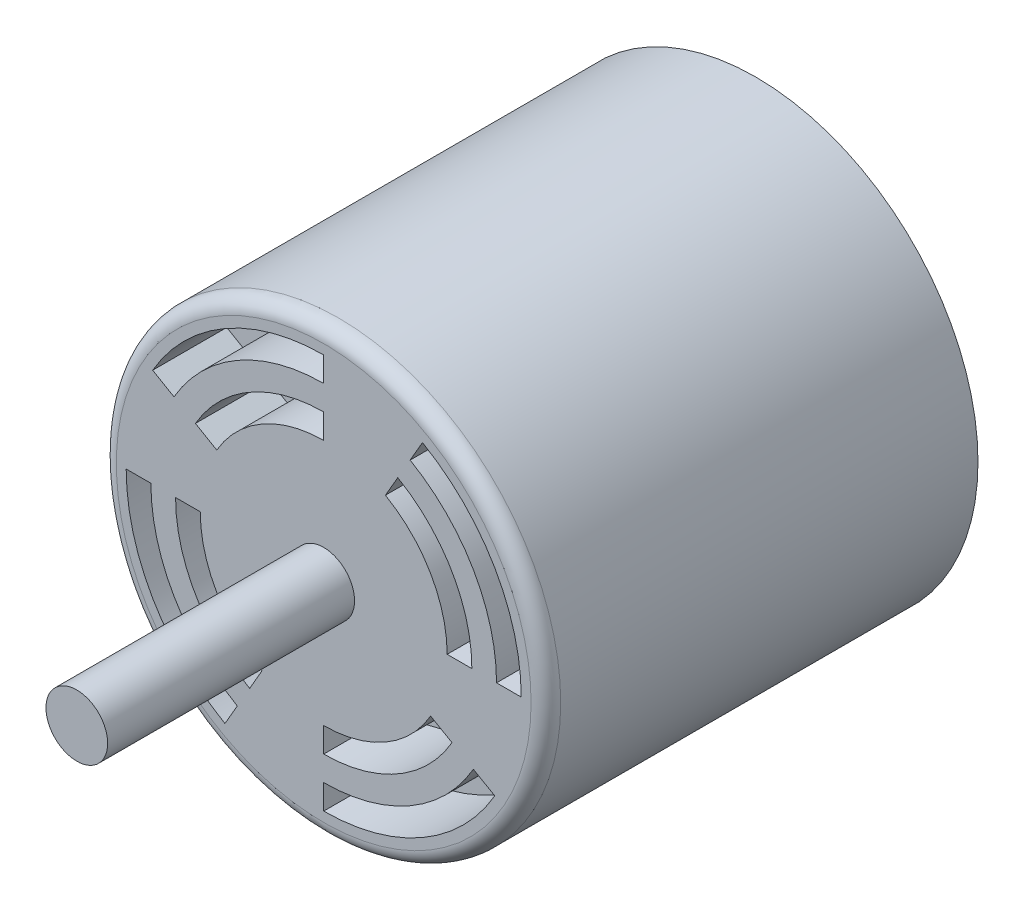
from build123d import *

# Parameters (mm, degrees)
SKETCH1_R           = 22.86
BOSS_EXTRUDE1_DEPTH = 44.45
SKETCH2_R           = 3.175
BOSS_EXTRUDE2_DEPTH = 25.4
CUT_EXTRUDE1_DEPTH  = 7.62
FILLET1_R           = 1.524


with BuildPart() as part:
    # Sketch1 → Boss-Extrude1 (new body)
    with BuildSketch(Plane.XY):
        Circle(SKETCH1_R)
    extrude(amount=BOSS_EXTRUDE1_DEPTH)

    # Sketch2 → Boss-Extrude2 (add)
    with BuildSketch(Plane.XY.offset(44.45)):
        Circle(SKETCH2_R)
    extrude(amount=BOSS_EXTRUDE2_DEPTH)

    # Sketch3 → Cut-Extrude1 (cut)
    with BuildSketch(Plane.XY.offset(44.45)):
        with BuildLine():
            Line((12.7, 0), (15.24, 0))
            ThreePointArc((15.24, 0), (13.198227154, 7.62), (7.62, 13.198227154))
            Line((7.62, 13.198227154), (6.35, 10.998522628))
            ThreePointArc((6.35, 10.998522628), (10.998522628, 6.35), (12.7, 0))
        make_face()
        with BuildLine():
            Line((8.89, 15.397931679), (10.16, 17.597636205))
            ThreePointArc((10.16, 17.597636205), (17.597636205, 10.16), (20.32, 0))
            Line((20.32, 0), (17.78, 0))
            ThreePointArc((17.78, 0), (15.397931679, 8.89), (8.89, 15.397931679))
        make_face()
        with BuildLine():
            Line((15.397931679, -8.89), (17.597636205, -10.16))
            ThreePointArc((17.597636205, -10.16), (10.16, -17.597636205), (0, -20.32))
            Line((0, -20.32), (0, -17.78))
            ThreePointArc((0, -17.78), (8.89, -15.397931679), (15.397931679, -8.89))
        make_face()
        with BuildLine():
            Line((10.998522628, -6.35), (13.198227154, -7.62))
            ThreePointArc((13.198227154, -7.62), (7.62, -13.198227154), (0, -15.24))
            Line((0, -15.24), (0, -12.7))
            ThreePointArc((0, -12.7), (6.35, -10.998522628), (10.998522628, -6.35))
        make_face()
        with BuildLine():
            Line((-8.89, -15.397931679), (-10.16, -17.597636205))
            ThreePointArc((-10.16, -17.597636205), (-17.597636205, -10.16), (-20.32, 0))
            Line((-20.32, 0), (-17.78, 0))
            ThreePointArc((-17.78, 0), (-15.397931679, -8.89), (-8.89, -15.397931679))
        make_face()
        with BuildLine():
            Line((-6.35, -10.998522628), (-7.62, -13.198227154))
            ThreePointArc((-7.62, -13.198227154), (-13.198227154, -7.62), (-15.24, 0))
            Line((-15.24, 0), (-12.7, 0))
            ThreePointArc((-12.7, 0), (-10.998522628, -6.35), (-6.35, -10.998522628))
        make_face()
        with BuildLine():
            Line((-15.397931679, 8.89), (-17.597636205, 10.16))
            ThreePointArc((-17.597636205, 10.16), (-10.16, 17.597636205), (0, 20.32))
            Line((0, 20.32), (0, 17.78))
            ThreePointArc((0, 17.78), (-8.89, 15.397931679), (-15.397931679, 8.89))
        make_face()
        with BuildLine():
            Line((-10.998522628, 6.35), (-13.198227154, 7.62))
            ThreePointArc((-13.198227154, 7.62), (-7.62, 13.198227154), (0, 15.24))
            Line((0, 15.24), (0, 12.7))
            ThreePointArc((0, 12.7), (-6.35, 10.998522628), (-10.998522628, 6.35))
        make_face()
    extrude(amount=-CUT_EXTRUDE1_DEPTH, mode=Mode.SUBTRACT)

    # Fillet1
    fillet1_edges = [part.edges().sort_by_distance(p)[0] for p in [
        (-22.86, 0, 44.45),
    ]]
    fillet(fillet1_edges, radius=FILLET1_R)


solid = part.part
